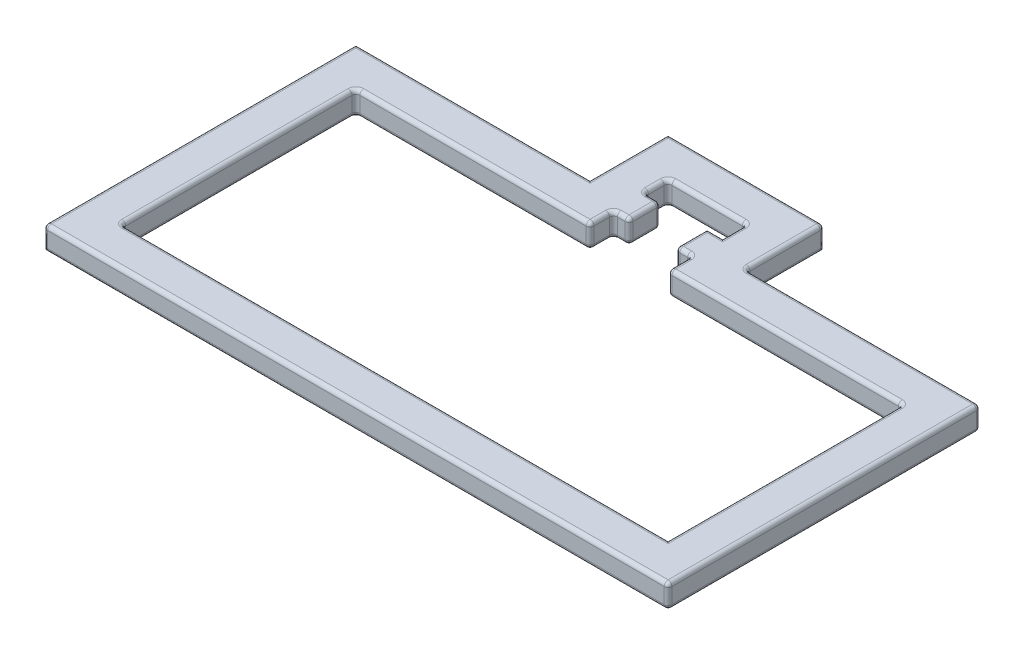
from build123d import *

# Parameters (mm, degrees)
SKETCH1_W           = 2
SKETCH1_H           = 4
BOSS_EXTRUDE1_DEPTH = 3
FILLET1_R           = 0.5


with BuildPart() as part:
    # Sketch1 → Boss-Extrude1 (new body)
    with BuildSketch(Plane(origin=(0, 0, 0), x_dir=(1, 0, 0), z_dir=(0, 1, 0))):
        Polygon((-54.811676083, 120.128212813), (-84.811676083, 120.128212813), (-84.811676083, 80.128212813), (-4.811676083, 80.128212813), (-4.811676083, 120.128212813), (-34.811676083, 120.128212813), (-39.811676083, 120.128212813), (-39.811676083, 118.128212813), (-39.811676083, 115.128212813), (-9.811676083, 115.128212813), (-9.811676083, 85.128212813), (-79.811676083, 85.128212813), (-79.811676083, 115.128212813), (-49.811676083, 115.128212813), (-49.811676083, 118.128212813), (-49.811676083, 120.128212813), align=None)
        Polygon((-54.811676083, 130.128212813), (-54.811676083, 120.128212813), (-49.811676083, 120.128212813), (-49.811676083, 122.128212813), (-49.811676083, 125.128212813), (-39.811676083, 125.128212813), (-39.811676083, 122.128212813), (-39.811676083, 120.128212813), (-34.811676083, 120.128212813), (-34.811676083, 130.128212813), align=None)
        with Locations((-48.811676083, 120.128212813)):
            Rectangle(SKETCH1_W, SKETCH1_H)
        with Locations((-40.811676083, 120.128212813)):
            Rectangle(SKETCH1_W, SKETCH1_H)
    extrude(amount=BOSS_EXTRUDE1_DEPTH)

    # Fillet1
    fillet1_edges = [part.edges().sort_by_distance(p)[0] for p in [
        (-39.811676083, 0, -116.628212813),
        (-19.811676083, 0, -120.128212813),
        (-39.811676083, 0, -123.628212813),
        (-9.811676083, 0, -100.128212813),
        (-44.811676083, 0, -85.128212813),
        (-48.811676083, 0, -122.128212813),
        (-40.811676083, 0, -118.128212813),
        (-40.811676083, 3, -122.128212813),
        (-41.811676083, 3, -120.128212813),
        (-40.811676083, 3, -118.128212813),
        (-41.811676083, 1.5, -118.128212813),
        (-47.811676083, 0, -120.128212813),
        (-48.811676083, 0, -118.128212813),
        (-48.811676083, 3, -122.128212813),
        (-47.811676083, 3, -120.128212813),
        (-48.811676083, 3, -118.128212813),
        (-47.811676083, 1.5, -122.128212813),
        (-47.811676083, 1.5, -118.128212813),
        (-34.811676083, 0, -125.128212813),
        (-44.811676083, 0, -80.128212813),
        (-4.811676083, 0, -100.128212813),
        (-44.811676083, 0, -125.128212813),
        (-24.811676083, 0, -115.128212813),
        (-79.811676083, 0, -100.128212813),
        (-64.811676083, 0, -115.128212813),
        (-49.811676083, 0, -116.628212813),
        (-49.811676083, 0, -123.628212813),
        (-19.811676083, 3, -120.128212813),
        (-34.811676083, 3, -125.128212813),
        (-44.811676083, 3, -130.128212813),
        (-54.811676083, 3, -125.128212813),
        (-69.811676083, 3, -120.128212813),
        (-84.811676083, 3, -100.128212813),
        (-44.811676083, 3, -80.128212813),
        (-4.811676083, 3, -100.128212813),
        (-44.811676083, 3, -125.128212813),
        (-39.811676083, 3, -116.628212813),
        (-39.811676083, 3, -123.628212813),
        (-24.811676083, 3, -115.128212813),
        (-9.811676083, 3, -100.128212813),
        (-44.811676083, 3, -85.128212813),
        (-79.811676083, 3, -100.128212813),
        (-64.811676083, 3, -115.128212813),
        (-49.811676083, 3, -116.628212813),
        (-49.811676083, 3, -123.628212813),
        (-4.811676083, 1.5, -120.128212813),
        (-4.811676083, 1.5, -80.128212813),
        (-84.811676083, 1.5, -80.128212813),
        (-34.811676083, 1.5, -130.128212813),
        (-34.811676083, 1.5, -120.128212813),
        (-49.811676083, 1.5, -125.128212813),
        (-49.811676083, 1.5, -115.128212813),
        (-79.811676083, 1.5, -115.128212813),
        (-79.811676083, 1.5, -85.128212813),
        (-9.811676083, 1.5, -115.128212813),
        (-39.811676083, 1.5, -115.128212813),
        (-39.811676083, 1.5, -125.128212813),
        (-49.811676083, 1.5, -122.128212813),
        (-49.811676083, 1.5, -118.128212813),
        (-39.811676083, 1.5, -118.128212813),
    ]]
    fillet(fillet1_edges, radius=FILLET1_R)


solid = part.part
